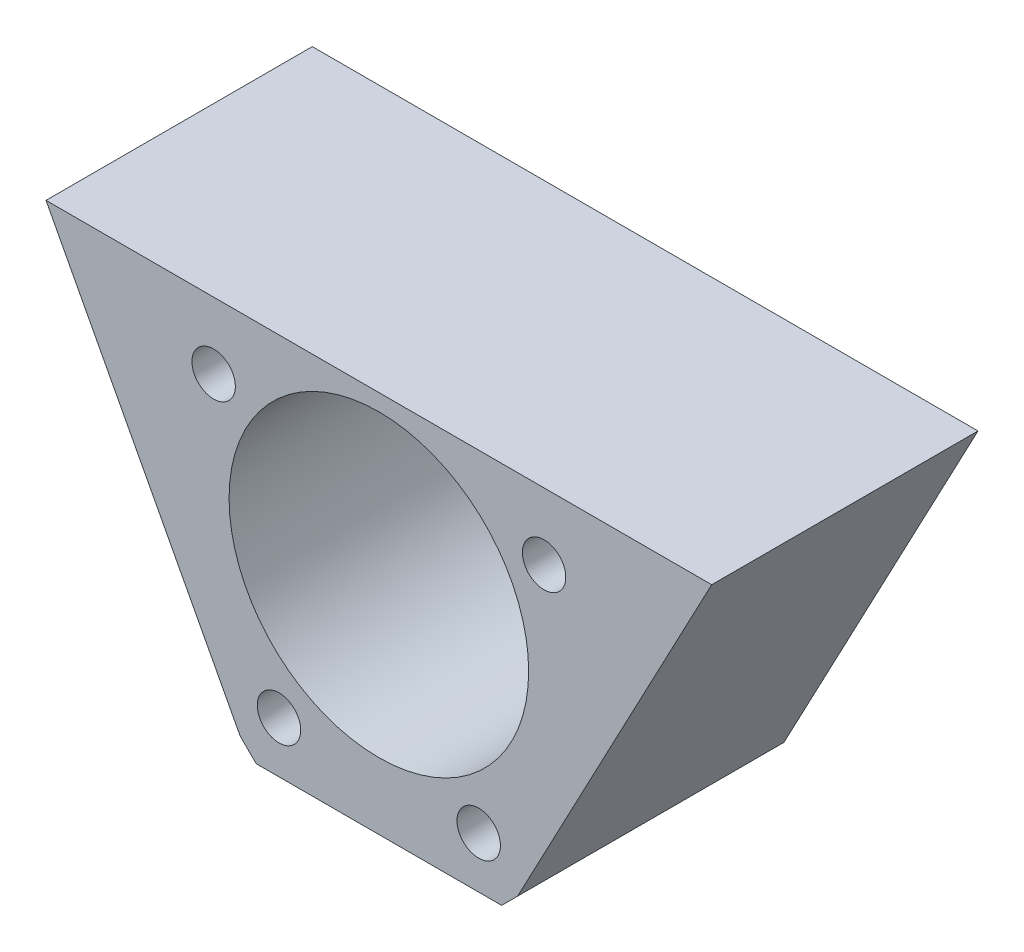
from build123d import *

# Parameters (mm, degrees)
BOSS_EXTRUDE1_DEPTH = 25.4
CUT_EXTRUDE1_DEPTH  = 46.597466007


with BuildPart() as part:
    # Sketch1 → Boss-Extrude1 (new body)
    with BuildSketch(Plane.XY):
        Polygon((-31.75, 15.875), (31.75, 15.875), (13.235753401, -19.110856459), (11.70910986, -20.6375), (-11.70910986, -20.6375), (-13.235753401, -19.110856459), align=None)
    extrude(amount=BOSS_EXTRUDE1_DEPTH)

    # Sketch2 → Cut-Extrude1 (cut, through all)
    with BuildSketch(Plane(origin=(0, 0, 0), x_dir=(-1, 0, 0), z_dir=(0, 0, -1))):
        with BuildLine():
            ThreePointArc((-7.4549, -15.76028553), (-9.525, -13.69018553), (-11.5951, -15.76028553))
            ThreePointArc((-11.5951, -15.76028553), (-9.525, -17.83038553), (-7.4549, -15.76028553))
        make_face()
        with BuildLine():
            ThreePointArc((11.5951, -15.76028553), (9.525, -13.69018553), (7.4549, -15.76028553))
            ThreePointArc((7.4549, -15.76028553), (9.525, -17.83038553), (11.5951, -15.76028553))
        make_face()
        with BuildLine():
            ThreePointArc((17.83038553, 9.525), (15.76028553, 11.5951), (13.69018553, 9.525))
            ThreePointArc((13.69018553, 9.525), (15.76028553, 7.4549), (17.83038553, 9.525))
        make_face()
        with BuildLine():
            ThreePointArc((-13.69018553, 9.525), (-15.76028553, 11.5951), (-17.83038553, 9.525))
            ThreePointArc((-17.83038553, 9.525), (-15.76028553, 7.4549), (-13.69018553, 9.525))
        make_face()
        with BuildLine():
            ThreePointArc((-14.2875, 0), (0, -14.2875), (14.2875, 0))
            ThreePointArc((14.2875, 0), (0, 14.2875), (-14.2875, 0))
        make_face()
    extrude(amount=-CUT_EXTRUDE1_DEPTH, mode=Mode.SUBTRACT)


solid = part.part
